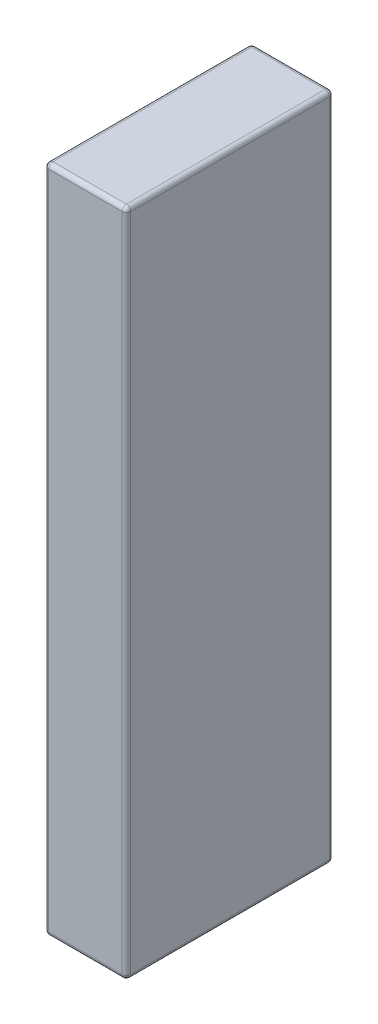
from build123d import *

# Parameters (mm, degrees)
SKETCH1_W           = 19
SKETCH1_H           = 155
BOSS_EXTRUDE1_DEPTH = 48
FILLET1_R           = 1


with BuildPart() as part:
    # Sketch1 → Boss-Extrude1 (new body)
    with BuildSketch(Plane.XY):
        Rectangle(SKETCH1_W, SKETCH1_H)
    extrude(amount=BOSS_EXTRUDE1_DEPTH)

    # Fillet1
    fillet1_edges = [part.edges().sort_by_distance(p)[0] for p in [
        (9.5, 0, 48),
        (0, 77.5, 48),
        (-9.5, 0, 48),
        (0, 77.5, 0),
        (9.5, 0, 0),
        (0, -77.5, 0),
        (-9.5, 0, 0),
        (-9.5, 77.5, 24),
        (9.5, 77.5, 24),
        (9.5, -77.5, 24),
        (-9.5, -77.5, 24),
        (0, -77.5, 48),
    ]]
    fillet(fillet1_edges, radius=FILLET1_R)


solid = part.part
